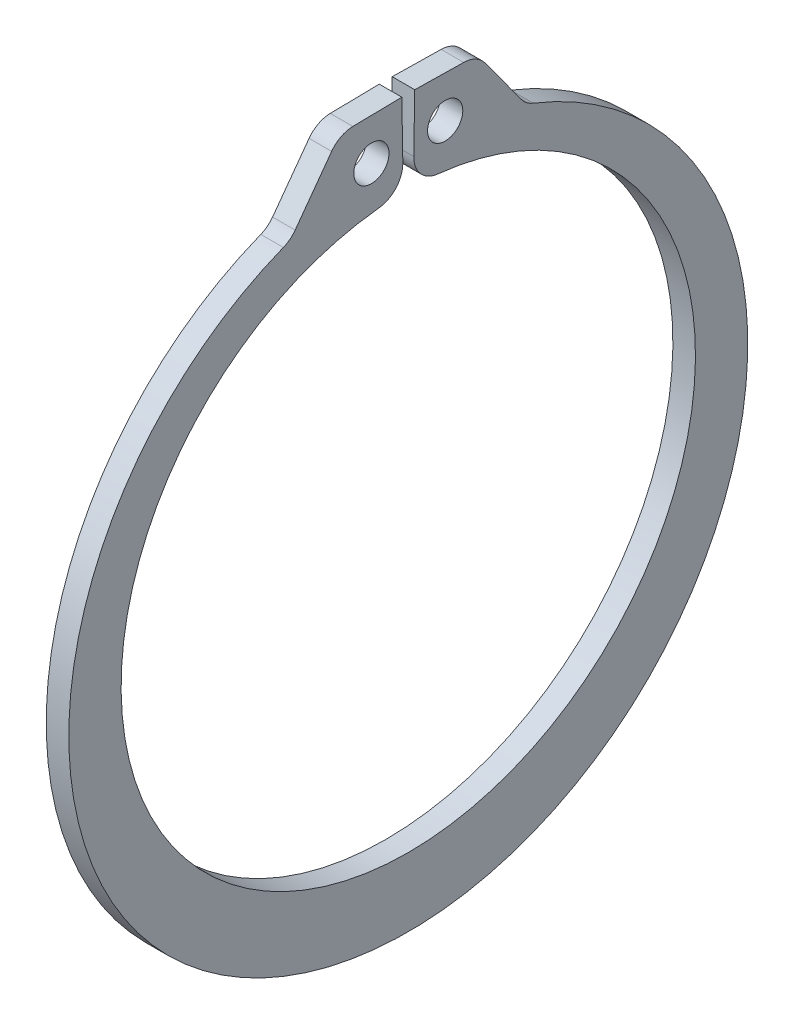
from build123d import *

# Parameters (mm, degrees)
BOSS_EXTRUDE1_DEPTH      = 0.635
BOSS_EXTRUDE1_DEPTH_BACK = 0.635
SKETCH3_R                = 0.9906
FILLET1_R                = 1.5113


with BuildPart() as part:
    # Sketch3 → Boss-Extrude1 (new, two sides: drawn at the far end of the back side and taken through both)
    with BuildSketch(Plane(origin=(0, 0, 0), x_dir=(0, 0, -1), z_dir=(1, 0, 0)).offset(-BOSS_EXTRUDE1_DEPTH_BACK)):
        with BuildLine():
            Line((-3.868164862, 20.76365362), (-6.626403534, 16.99076926))
            ThreePointArc((-6.626403534, 16.99076926), (0, -20.0152), (6.626403534, 16.99076926))
            Line((6.626403534, 16.99076926), (3.868164862, 20.76365362))
            Line((3.868164862, 20.76365362), (0.363498721, 20.824827795))
            Line((0.363498721, 20.824827795), (0.281933155, 16.151939607))
            ThreePointArc((0.281933155, 16.151939607), (0, -16.1544), (-0.281933155, 16.151939607))
            Line((-0.281933155, 16.151939607), (-0.363498721, 20.824827795))
            Line((-0.363498721, 20.824827795), (-3.868164862, 20.76365362))
        make_face()
        with Locations((-2.075049008, 18.457796613)):
            Circle(SKETCH3_R, mode=Mode.SUBTRACT)
        with Locations((2.075049008, 18.457796613)):
            Circle(SKETCH3_R, mode=Mode.SUBTRACT)
    extrude(amount=BOSS_EXTRUDE1_DEPTH + BOSS_EXTRUDE1_DEPTH_BACK)

    # Fillet1
    fillet1_edges = [part.edges().sort_by_distance(p)[0] for p in [
        (0, 16.99076926, 6.626403534),
        (0, 20.76365362, 3.868164862),
        (0, 16.151939607, 0.281933155),
        (0, 16.151939607, -0.281933155),
        (0, 20.76365362, -3.868164862),
        (0, 16.99076926, -6.626403534),
    ]]
    fillet(fillet1_edges, radius=FILLET1_R)


solid = part.part
